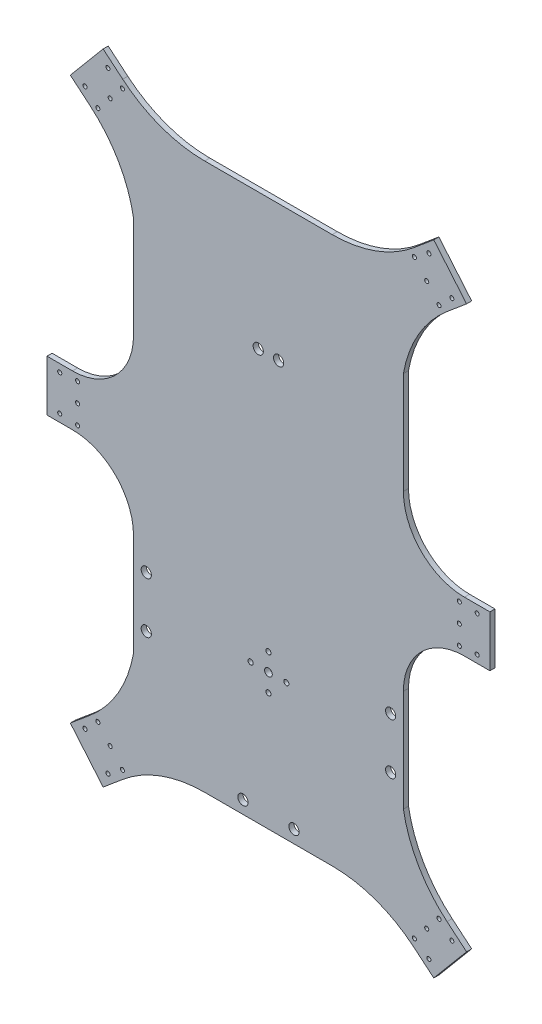
from build123d import *

# Parameters (mm, degrees)
EXTRUDE_1_DEPTH     = 2
SKETCH_2_R          = 0.8
SKETCH_2_R_2        = 2
CUT_EXTRUDE_1_DEPTH = 10
SKETCH_3_R          = 1.5
SKETCH_3_R_2        = 1
CUT_EXTRUDE_2_DEPTH = 249.131112982
SKETCH_4_R          = 2
CUT_EXTRUDE_3_DEPTH = 10


with BuildPart() as part:
    # 草图1 → 凸台-拉伸1 (new body)
    with BuildSketch(Plane.XY):
        with BuildLine():
            Line((-52.894125512, 33.242924291), (-52.894125512, 73.242924291))
            ThreePointArc((-52.894125512, 73.242924291), (-59.898712726, 90.153493742), (-76.809282177, 97.158080957))
            Line((-76.809282177, 97.158080957), (-86.809282177, 97.158080957))
            Line((-86.809282177, 97.158080957), (-86.809282177, 117.158080957))
            Line((-86.809282177, 117.158080957), (-76.809282177, 117.158080957))
            ThreePointArc((-76.809282177, 117.158080957), (-59.898712726, 124.162668171), (-52.894125512, 141.073237622))
            Line((-52.894125512, 141.073237622), (-52.894125512, 181.073237622))
            ThreePointArc((-52.894125512, 181.073237622), (-58.833242973, 197.390828739), (-69.995132678, 210.693050895))
            Line((-69.995132678, 210.693050895), (-77.655577109, 217.120926992))
            Line((-77.655577109, 217.120926992), (-64.799824916, 232.441815854))
            Line((-64.799824916, 232.441815854), (-57.139380484, 226.013939757))
            ThreePointArc((-57.139380484, 226.013939757), (-42.101007166, 217.331530874), (-25, 214.316161913))
            Line((-25, 214.316161913), (25, 214.316161913))
            ThreePointArc((25, 214.316161913), (42.101007166, 217.331530874), (57.139380484, 226.013939757))
            Line((57.139380484, 226.013939757), (64.799824916, 232.441815854))
            Line((64.799824916, 232.441815854), (77.655577109, 217.120926992))
            Line((77.655577109, 217.120926992), (69.995132678, 210.693050895))
            ThreePointArc((69.995132678, 210.693050895), (58.833242973, 197.390828739), (52.894125512, 181.073237622))
            Line((52.894125512, 181.073237622), (52.894125512, 141.073237622))
            ThreePointArc((52.894125512, 141.073237622), (59.898712726, 124.162668171), (76.809282177, 117.158080957))
            Line((76.809282177, 117.158080957), (86.809282177, 117.158080957))
            Line((86.809282177, 117.158080957), (86.809282177, 97.158080957))
            Line((86.809282177, 97.158080957), (76.809282177, 97.158080957))
            ThreePointArc((76.809282177, 97.158080957), (59.898712726, 90.153493742), (52.894125512, 73.242924291))
            Line((52.894125512, 73.242924291), (52.894125512, 33.242924291))
            ThreePointArc((52.894125512, 33.242924291), (58.833242973, 16.925333174), (69.995132678, 3.623111018))
            Line((69.995132678, 3.623111018), (77.655577109, -2.804765079))
            Line((77.655577109, -2.804765079), (64.799824916, -18.125653941))
            Line((64.799824916, -18.125653941), (57.139380484, -11.697777844))
            ThreePointArc((57.139380484, -11.697777844), (42.101007166, -3.015368961), (25, 0))
            Line((25, 0), (-25, 0))
            ThreePointArc((-25, 0), (-42.101007166, -3.015368961), (-57.139380484, -11.697777844))
            Line((-57.139380484, -11.697777844), (-64.799824916, -18.125653941))
            Line((-64.799824916, -18.125653941), (-77.655577109, -2.804765079))
            Line((-77.655577109, -2.804765079), (-69.995132678, 3.623111018))
            ThreePointArc((-69.995132678, 3.623111018), (-58.833242973, 16.925333174), (-52.894125512, 33.242924291))
        make_face()
    extrude(amount=EXTRUDE_1_DEPTH)

    # 草图2 → 切除-拉伸1 (cut)
    with BuildSketch(Plane.XY.offset(2)):
        with Locations((-62.035167695, 217.067920107)):
            Circle(SKETCH_2_R)
        with Locations((-71.896992065, 216.205122273)):
            Circle(SKETCH_2_R)
        with Locations((-62.897965529, 226.929744476)):
            Circle(SKETCH_2_R)
        with Locations((-81.809282177, 100.158080957)):
            Circle(SKETCH_2_R)
        with Locations((-74.809282177, 107.158080957)):
            Circle(SKETCH_2_R)
        with Locations((-81.809282177, 114.158080957)):
            Circle(SKETCH_2_R)
        with Locations((81.809282177, 114.158080957)):
            Circle(SKETCH_2_R)
        with Locations((74.809282177, 107.158080957)):
            Circle(SKETCH_2_R)
        with Locations((81.809282177, 100.158080957)):
            Circle(SKETCH_2_R)
        with Locations((71.896992065, 216.205122273)):
            Circle(SKETCH_2_R)
        with Locations((62.035167695, 217.067920107)):
            Circle(SKETCH_2_R)
        with Locations((62.897965529, 226.929744476)):
            Circle(SKETCH_2_R)
        with Locations((71.896992065, -1.888960359)):
            Circle(SKETCH_2_R)
        with Locations((62.035167695, -2.751758193)):
            Circle(SKETCH_2_R)
        with Locations((62.897965529, -12.613582563)):
            Circle(SKETCH_2_R)
        with Locations((-71.896992065, -1.888960359)):
            Circle(SKETCH_2_R)
        with Locations((-62.035167695, -2.751758193)):
            Circle(SKETCH_2_R)
        with Locations((-62.897965529, -12.613582563)):
            Circle(SKETCH_2_R)
        with Locations((-47.894125512, 63.242924291)):
            Circle(SKETCH_2_R_2)
        with Locations((-47.894125512, 43.242924291)):
            Circle(SKETCH_2_R_2)
        with Locations((47.894125512, 43.242924291)):
            Circle(SKETCH_2_R_2)
        with Locations((47.894125512, 63.242924291)):
            Circle(SKETCH_2_R_2)
        with Locations((-10, 5)):
            Circle(SKETCH_2_R_2)
        with Locations((10, 5)):
            Circle(SKETCH_2_R_2)
        with Locations((-74.809282177, 114.658080957)):
            Circle(SKETCH_2_R)
        with Locations((-74.809282177, 99.658080957)):
            Circle(SKETCH_2_R)
        with Locations((74.809282177, 114.658080957)):
            Circle(SKETCH_2_R)
        with Locations((74.809282177, 99.658080957)):
            Circle(SKETCH_2_R)
        with Locations((66.856074768, 2.99357513)):
            Circle(SKETCH_2_R)
        with Locations((57.214260622, -8.497091517)):
            Circle(SKETCH_2_R)
        with Locations((-57.214260622, -8.497091517)):
            Circle(SKETCH_2_R)
        with Locations((-66.856074768, 2.99357513)):
            Circle(SKETCH_2_R)
        with Locations((-57.214260622, 222.81325343)):
            Circle(SKETCH_2_R)
        with Locations((-66.856074768, 211.322586783)):
            Circle(SKETCH_2_R)
        with Locations((66.856074768, 211.322586783)):
            Circle(SKETCH_2_R)
        with Locations((57.214260622, 222.81325343)):
            Circle(SKETCH_2_R)
    extrude(amount=-CUT_EXTRUDE_1_DEPTH, mode=Mode.SUBTRACT)

    # 草图3 → 切除-拉伸2 (cut, through all)
    with BuildSketch(Plane.XY.offset(2)):
        with Locations((0, 53.242924291)):
            Circle(SKETCH_3_R)
        with Locations((0, 60.242924291)):
            Circle(SKETCH_3_R_2)
        with Locations((7, 53.242924291)):
            Circle(SKETCH_3_R_2)
        with Locations((0, 46.242924291)):
            Circle(SKETCH_3_R_2)
        with Locations((-7, 53.242924291)):
            Circle(SKETCH_3_R_2)
    extrude(amount=-CUT_EXTRUDE_2_DEPTH, mode=Mode.SUBTRACT)

    # 草图4 → 切除-拉伸3 (cut)
    with BuildSketch(Plane.XY.offset(2)):
        with Locations((4, 161.073237622)):
            Circle(SKETCH_4_R)
        with Locations((-4, 161.073237622)):
            Circle(SKETCH_4_R)
    extrude(amount=-CUT_EXTRUDE_3_DEPTH, mode=Mode.SUBTRACT)


solid = part.part
